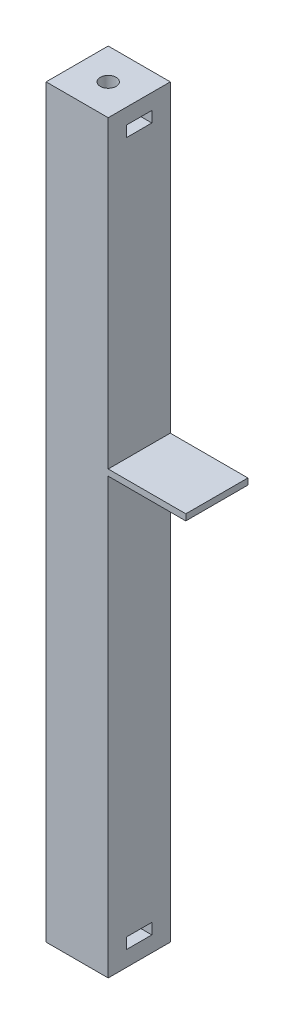
from build123d import *

# Parameters (mm, degrees)
ESQUISSE1_W             = 20
ESQUISSE1_H             = 20
BOSS_EXTRU_2_DEPTH      = 240
ESQUISSE5_W             = 8.1
ESQUISSE5_H             = 3.5
ENL_V_MAT_EXTRU_2_DEPTH = 10
ESQUISSE6_R             = 2.55
ENL_V_MAT_EXTRU_3_DEPTH = 25
ENL_V_START             = 3.5
ENL_V_MAT_EXTRU_5_DEPTH = 3.5
ENL_V_START_2           = -25
ESQUISSE9_R             = 2.55
ENL_V_MAT_EXTRU_6_DEPTH = 25
ESQUISSE10_W            = 20
ESQUISSE10_H            = 2
BOSS_EXTRU_5_DEPTH      = 25


with BuildPart() as part:
    # Esquisse1 → Boss.-Extru.2 (new body)
    with BuildSketch(Plane(origin=(0, 0, 0), x_dir=(1, 0, 0), z_dir=(0, 1, 0))):
        Rectangle(ESQUISSE1_W, ESQUISSE1_H)
    extrude(amount=BOSS_EXTRU_2_DEPTH)

    # Esquisse5 → Enlèv. mat.-Extru.2 (cut)
    with BuildSketch(Plane(origin=(10, 0, 0), x_dir=(0, 0, -1), z_dir=(1, 0, 0))):
        with Locations((0, 233.25)):
            Rectangle(ESQUISSE5_W, ESQUISSE5_H)
        with Locations((0, 6.75)):
            Rectangle(ESQUISSE5_W, ESQUISSE5_H)
    extrude(amount=-ENL_V_MAT_EXTRU_2_DEPTH, mode=Mode.SUBTRACT)

    # Esquisse6 → Enlèv. mat.-Extru.3 (cut)
    with BuildSketch(Plane(origin=(0, 240, 0), x_dir=(1, 0, 0), z_dir=(0, 1, 0))):
        with Locations(Location((0, 0, 0), (0, 0, 270))):
            Circle(ESQUISSE6_R)
    extrude(amount=-ENL_V_MAT_EXTRU_3_DEPTH, mode=Mode.SUBTRACT)

    # Esquisse7 → Enlèv. mat.-Extru.5 (cut)
    with BuildSketch(Plane(origin=(0, 231.5, 0), x_dir=(1, 0, 0), z_dir=(0, 1, 0)).offset(ENL_V_START)):
        with BuildLine():
            Line((-2.33826859, -4.05), (0, -4.05))
            Line((0, -4.05), (0, -2.55))
            ThreePointArc((0, -2.55), (-2.55, 0), (0, 2.55))
            Line((0, 2.55), (0, 4.05))
            Line((0, 4.05), (-2.33826859, 4.05))
            Line((-2.33826859, 4.05), (-4.67653718, 0))
            Line((-4.67653718, 0), (-2.33826859, -4.05))
        make_face()
    extrude(amount=-ENL_V_MAT_EXTRU_5_DEPTH, mode=Mode.SUBTRACT)

    # Esquisse9 → Enlèv. mat.-Extru.6 (cut)
    with BuildSketch(Plane.XZ.offset(ENL_V_START_2)):
        with Locations(Location((0, 0, 0), (0, 0, 90))):
            Circle(ESQUISSE9_R)
    extrude(amount=ENL_V_MAT_EXTRU_6_DEPTH, mode=Mode.SUBTRACT)

    # Esquisse10 → Boss.-Extru.5 (add)
    with BuildSketch(Plane(origin=(10, 0, 0), x_dir=(0, 0, -1), z_dir=(1, 0, 0))):
        with Locations((0, 141)):
            Rectangle(ESQUISSE10_W, ESQUISSE10_H)
    extrude(amount=BOSS_EXTRU_5_DEPTH)


solid = part.part
